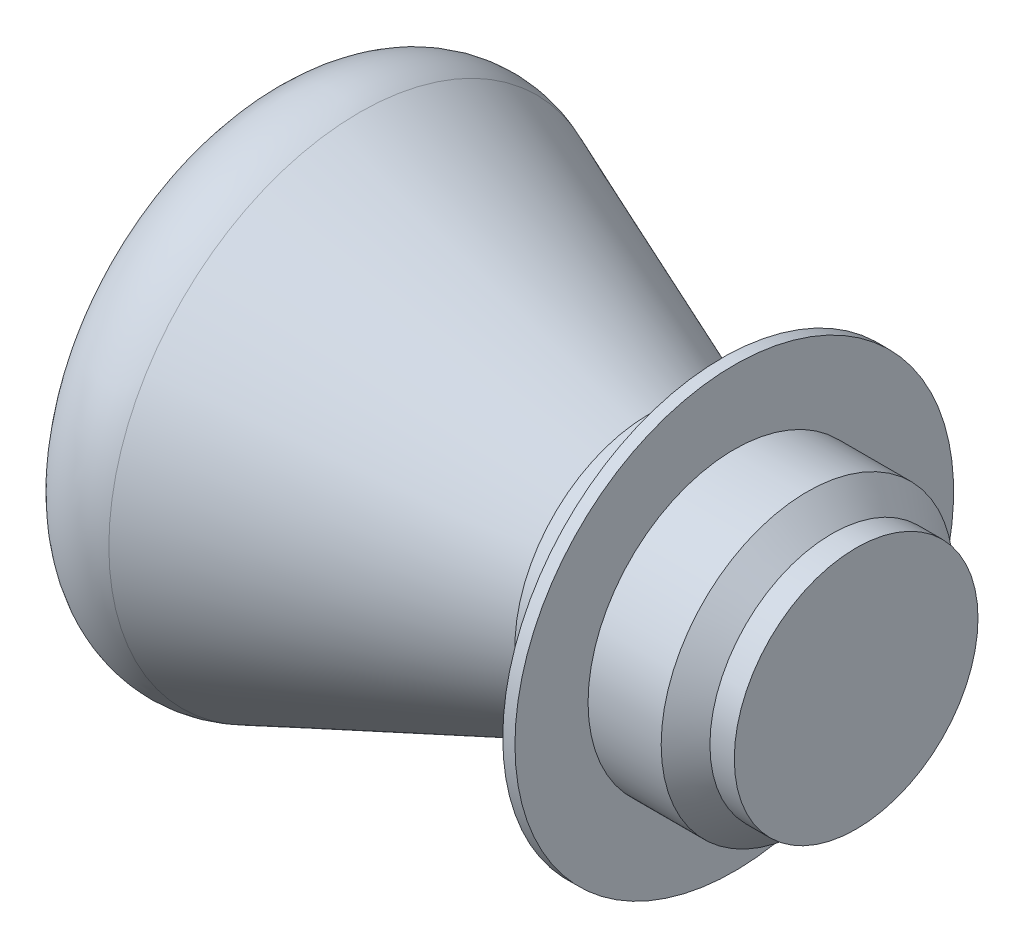
from build123d import *


with BuildPart() as part:
    # Szkic1 → Obrót1 (revolve)
    with BuildSketch(Plane.XY, mode=Mode.PRIVATE) as obr_t1_sk:
        Polygon((0, 0), (5.5, 0), (5.5, 5), (4.5, 5), (3.5, 6), (0.5, 6), (0.5, 9), (0, 9), (0, 6), (-2, 6), (-2, 5.5), (0, 5.5), align=None)
    revolve(obr_t1_sk.sketch.rotate(Axis((0, 0, 0), (1, 0, 0)), 90), axis=Axis((0, 0, 0), (1, 0, 0)))


with BuildPart() as body_2:
    # Szkic2 → Obrót2 (revolve)
    with BuildSketch(Plane.XY, mode=Mode.PRIVATE) as obr_t2_sk:
        with BuildLine():
            Line((0, 0), (0, 5.5))
            Line((0, 5.5), (-3, 5.5))
            Line((-3, 5.5), (-14.879552076, 10.282911506))
            ThreePointArc((-14.879552076, 10.282911506), (-17.466149273, 10.117328086), (-18.958363304, 7.998082886))
            ThreePointArc((-18.958363304, 7.998082886), (-19.151136536, 3.964890249), (-18.387297757, 0))
            Line((-18.387297757, 0), (0, 0))
        make_face()
    revolve(obr_t2_sk.sketch.rotate(Axis((-18.387297757, 0, 0), (1, 0, 0)), 180), axis=Axis((-18.387297757, 0, 0), (1, 0, 0)))


solid = Compound([part.part, body_2.part])
